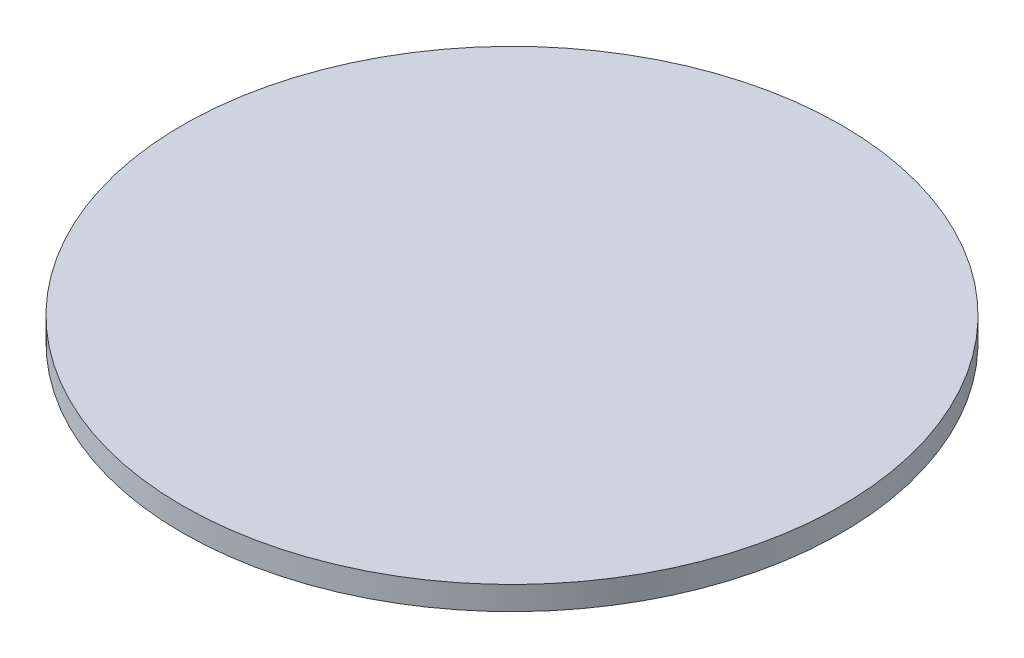
from build123d import *

# Parameters (mm, degrees)
SKETCH1_R           = 88.9
BOSS_EXTRUDE1_DEPTH = 6.35


with BuildPart() as part:
    # Sketch1 → Boss-Extrude1 (new body)
    with BuildSketch(Plane(origin=(0, 0, 0), x_dir=(1, 0, 0), z_dir=(0, 1, 0))):
        with Locations(Location((0, 0, 0), (0, 0, 270))):
            Circle(SKETCH1_R)
    extrude(amount=BOSS_EXTRUDE1_DEPTH)


solid = part.part
